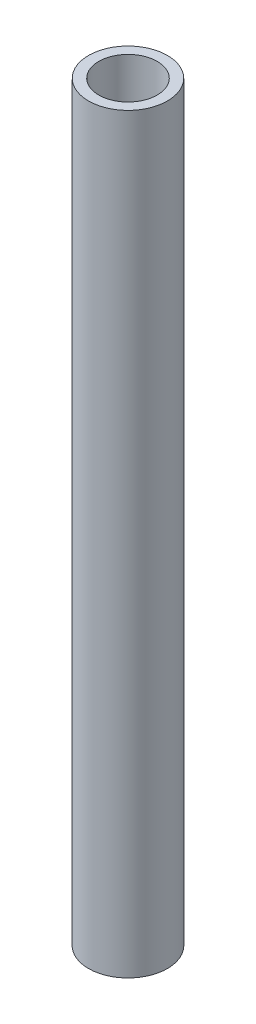
from build123d import *

# Parameters (mm, degrees)
SKETCH1_R           = 10.668
SKETCH1_R_2         = 7.8994
BOSS_EXTRUDE1_DEPTH = 203.2


with BuildPart() as part:
    # Sketch1 → Boss-Extrude1 (new body)
    with BuildSketch(Plane(origin=(0, 0, 0), x_dir=(1, 0, 0), z_dir=(0, 1, 0))):
        with Locations(Location((0, 0, 0), (0, 0, 270))):
            Circle(SKETCH1_R)
        with Locations(Location((0, 0, 0), (0, 0, 270))):
            Circle(SKETCH1_R_2, mode=Mode.SUBTRACT)
    extrude(amount=BOSS_EXTRUDE1_DEPTH)


solid = part.part
